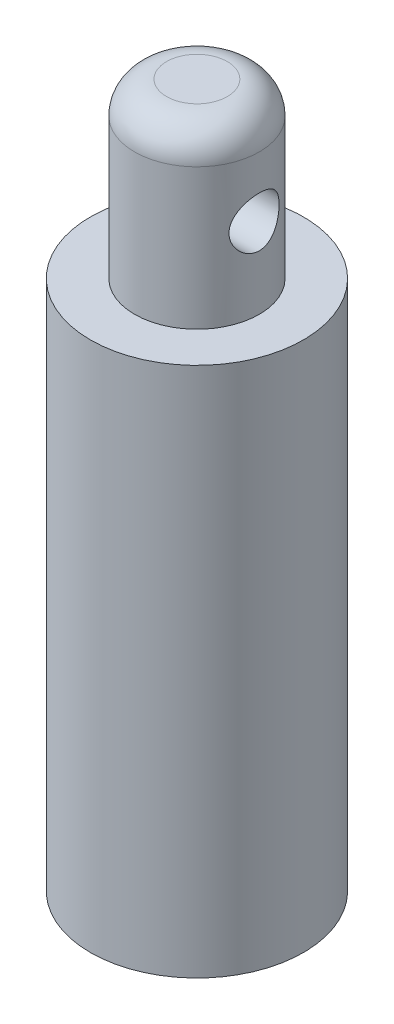
from build123d import *

# Parameters (mm, degrees)
SKETCH1_R               = 5
BOSS_EXTRUDE1_DEPTH     = 24.9
SKETCH2_R               = 2.925
BOSS_EXTRUDE2_DEPTH     = 8.1
FILLET1_R               = 1.5
CUT_EXTRUDE1_DEPTH      = 34.749074061
CUT_EXTRUDE1_DEPTH_BACK = 34.749074061
SKETCH3_R               = 1.175
SKETCH4_R               = 1.25
CUT_EXTRUDE2_DEPTH      = 10


with BuildPart() as part:
    # Sketch1 → Boss-Extrude1 (new body)
    with BuildSketch(Plane(origin=(0, 0, 0), x_dir=(1, 0, 0), z_dir=(0, 1, 0))):
        with Locations(Location((0, 0, 0), (0, 0, 270))):
            Circle(SKETCH1_R)
    extrude(amount=BOSS_EXTRUDE1_DEPTH)

    # Sketch2 → Boss-Extrude2 (add)
    with BuildSketch(Plane(origin=(0, 24.9, 0), x_dir=(1, 0, 0), z_dir=(0, 1, 0))):
        with Locations(Location((0, 0, 0), (0, 0, 90))):
            Circle(SKETCH2_R)
    extrude(amount=BOSS_EXTRUDE2_DEPTH)

    # Fillet1
    fillet1_edges = [part.edges().sort_by_distance(p)[0] for p in [
        (0, 33, 2.925),
    ]]
    fillet(fillet1_edges, radius=FILLET1_R)

    # Sketch3 → Cut-Extrude1 (cut, two sides: drawn at the far end of the back side and taken through both)
    with BuildSketch(Plane(origin=(0, 0, 0), x_dir=(0, 0, -1), z_dir=(1, 0, 0)).offset(-CUT_EXTRUDE1_DEPTH_BACK)):
        with Locations((0, 28.66)):
            Circle(SKETCH3_R)
    extrude(amount=CUT_EXTRUDE1_DEPTH + CUT_EXTRUDE1_DEPTH_BACK, mode=Mode.SUBTRACT)

    # Sketch4 → Cut-Extrude2 (cut)
    with BuildSketch(Plane.XZ):
        with Locations(Location((0, 0, 0), (0, 0, 270))):
            Circle(SKETCH4_R)
    extrude(amount=-CUT_EXTRUDE2_DEPTH, mode=Mode.SUBTRACT)


solid = part.part
